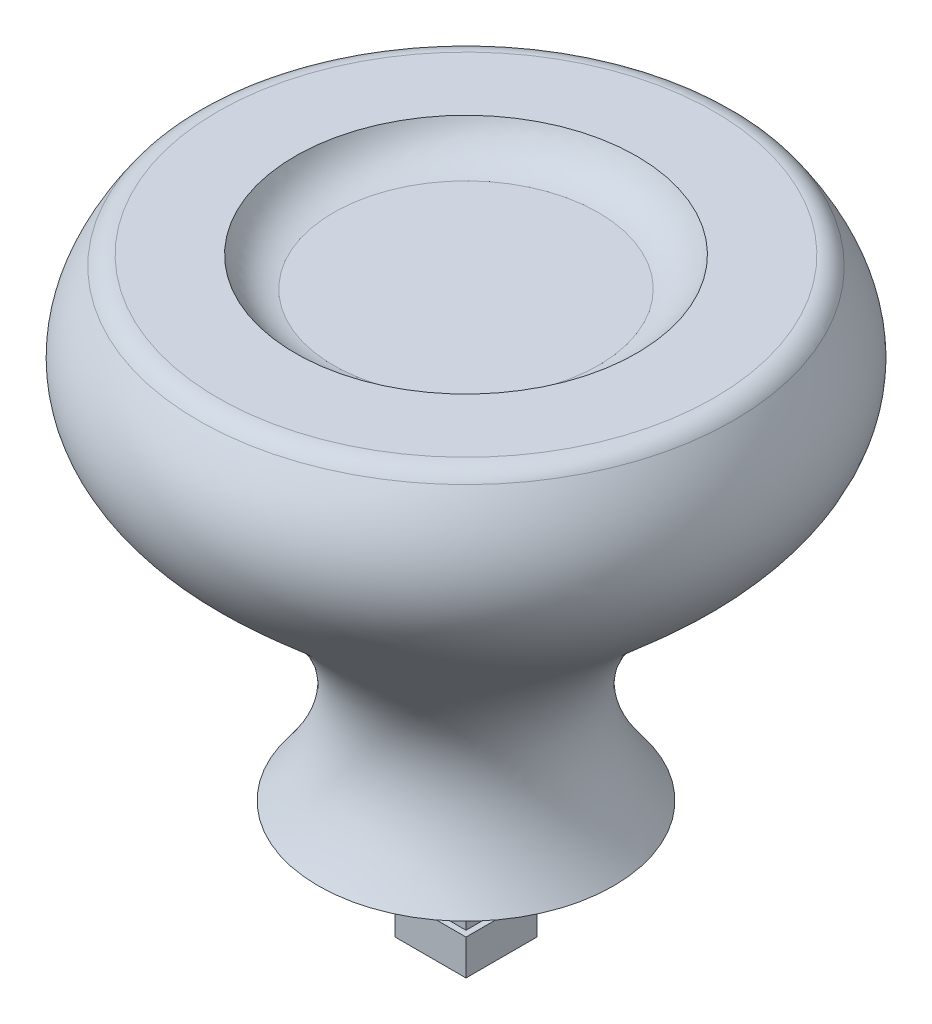
from build123d import *

# Parameters (mm, degrees)
CONG_2_R           = 2
ESQUISSE3_W        = 5
ESQUISSE3_H        = 5
BOSS_EXTRU_1_DEPTH = 10
ESQUISSE4_W        = 6
ESQUISSE4_H        = 6
BOSS_EXTRU_2_DEPTH = 3


with BuildPart() as part:
    # Esquisse1 → Révolution1 (revolve)
    with BuildSketch(Plane.XY):
        with BuildLine():
            Line((0, 0), (12.5, 0))
            add(Edge.make_bspline(
                [(12.5, 0), (-2.792999131, 19.477640693), (36.048194097, 21.903623333), (22, 40)],
                knots=[0, 0, 0, 0, 1, 1, 1, 1], degree=3))
            Line((22, 40), (0, 40))
            Line((0, 40), (0, 0))
        make_face()
    revolve(axis=Axis((0, 0, 0), (0, 1, 0)))

    # Esquisse2 → Enlèvement de matière-Révolution1 (revolve, cut)
    with BuildSketch(Plane.XY):
        with BuildLine():
            Line((-14.44702814, 40), (0, 40))
            Line((0, 40), (0, 37.486983962))
            Line((0, 37.486983962), (-11.204408598, 37.486983962))
            add(Edge.make_bspline(
                [(-14.44702814, 40), (-13.476590785, 37.876911576), (-11.204408598, 37.486983962)],
                knots=[0, 0, 0, 1, 1, 1], degree=2))
        make_face()
    revolve(axis=Axis((0, -3.04576032, 0), (0, 1, 0)), mode=Mode.SUBTRACT)

    # Congé2
    cong_2_edges = [part.edges().sort_by_distance(p)[0] for p in [
        (-22, 40, 0),
    ]]
    fillet(cong_2_edges, radius=CONG_2_R)

    # Esquisse3 → Boss.-Extru.1 (add)
    with BuildSketch(Plane.XZ):
        Rectangle(ESQUISSE3_W, ESQUISSE3_H)
    extrude(amount=BOSS_EXTRU_1_DEPTH)

    # Esquisse4 → Boss.-Extru.2 (add)
    with BuildSketch(Plane.XZ.offset(10)):
        Rectangle(ESQUISSE4_W, ESQUISSE4_H)
    extrude(amount=-BOSS_EXTRU_2_DEPTH)


solid = part.part
